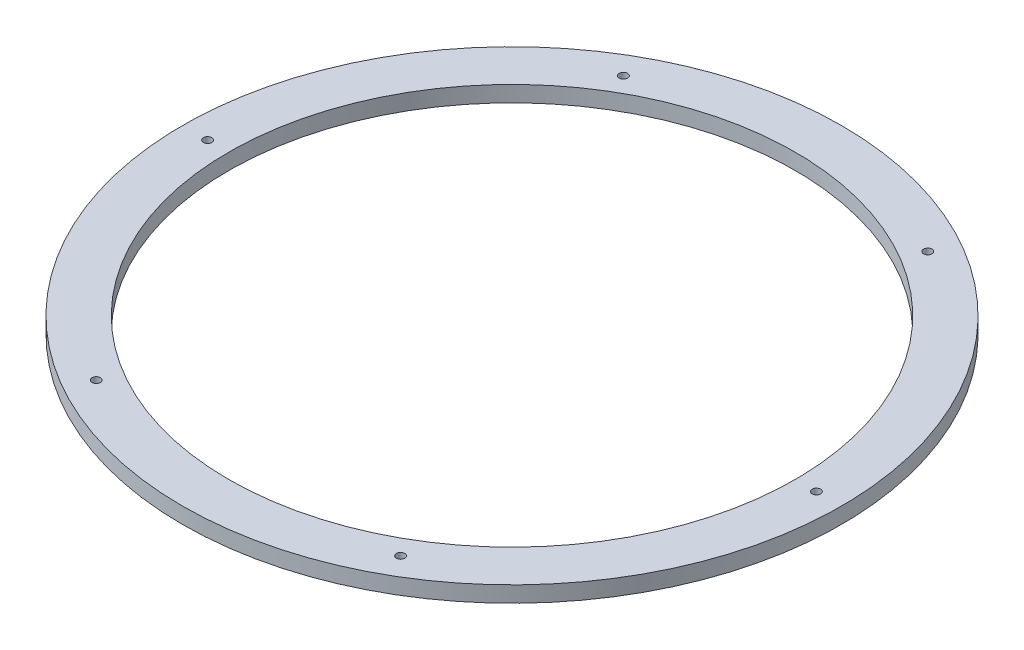
from build123d import *

# Parameters (mm, degrees)
SKETCH1_R           = 392.5
SKETCH1_R_2         = 337.5
BOSS_EXTRUDE1_DEPTH = 9.5
SKETCH2_R           = 5
CUT_EXTRUDE1_DEPTH  = 556.40390708


with BuildPart() as part:
    # Sketch1 → Boss-Extrude1 (new, symmetric)
    with BuildSketch(Plane(origin=(0, 0, 0), x_dir=(1, 0, 0), z_dir=(0, 1, 0))):
        with Locations(Location((0, 0, 0), (0, 0, 270))):
            Circle(SKETCH1_R)
        with Locations(Location((0, 0, 0), (0, 0, 270))):
            Circle(SKETCH1_R_2, mode=Mode.SUBTRACT)
    extrude(amount=BOSS_EXTRUDE1_DEPTH, both=True)

    # Sketch2 → Cut-Extrude1 (cut, through all)
    with BuildSketch(Plane(origin=(0, 9.5, 0), x_dir=(1, 0, 0), z_dir=(0, 1, 0))):
        with Locations(Location((181.25, 313.934208872, 0), (0, 0, 270))):
            Circle(SKETCH2_R)
        with Locations(Location((362.5, 0, 0), (0, 0, 270))):
            Circle(SKETCH2_R)
        with Locations(Location((181.25, -313.934208872, 0), (0, 0, 270))):
            Circle(SKETCH2_R)
        with Locations(Location((-181.25, -313.934208872, 0), (0, 0, 270))):
            Circle(SKETCH2_R)
        with Locations(Location((-362.5, 0, 0), (0, 0, 270))):
            Circle(SKETCH2_R)
        with Locations(Location((-181.25, 313.934208872, 0), (0, 0, 270))):
            Circle(SKETCH2_R)
    extrude(amount=-CUT_EXTRUDE1_DEPTH, mode=Mode.SUBTRACT)


solid = part.part
